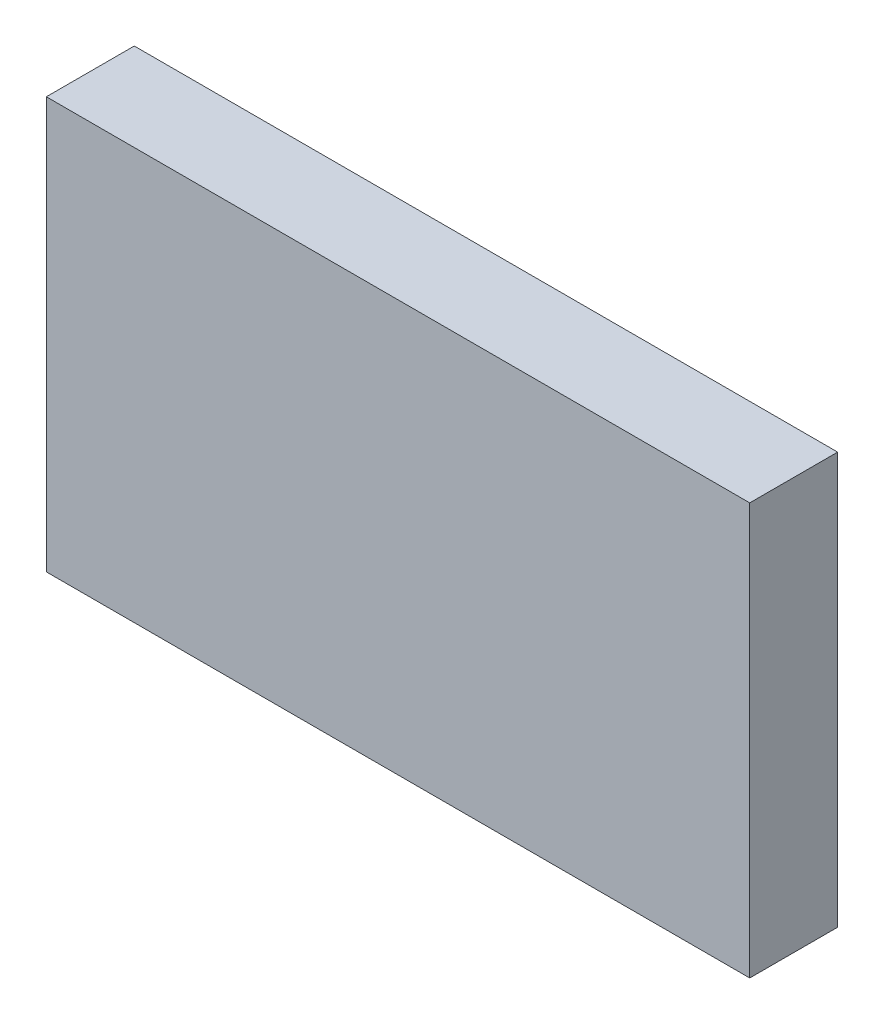
from build123d import *

# Parameters (mm, degrees)
SKETCH1_W           = 50.8
SKETCH1_H           = 29.718
BOSS_EXTRUDE1_DEPTH = 6.35


with BuildPart() as part:
    # Sketch1 → Boss-Extrude1 (new body)
    with BuildSketch(Plane.XY):
        Rectangle(SKETCH1_W, SKETCH1_H)
    extrude(amount=BOSS_EXTRUDE1_DEPTH)


solid = part.part
